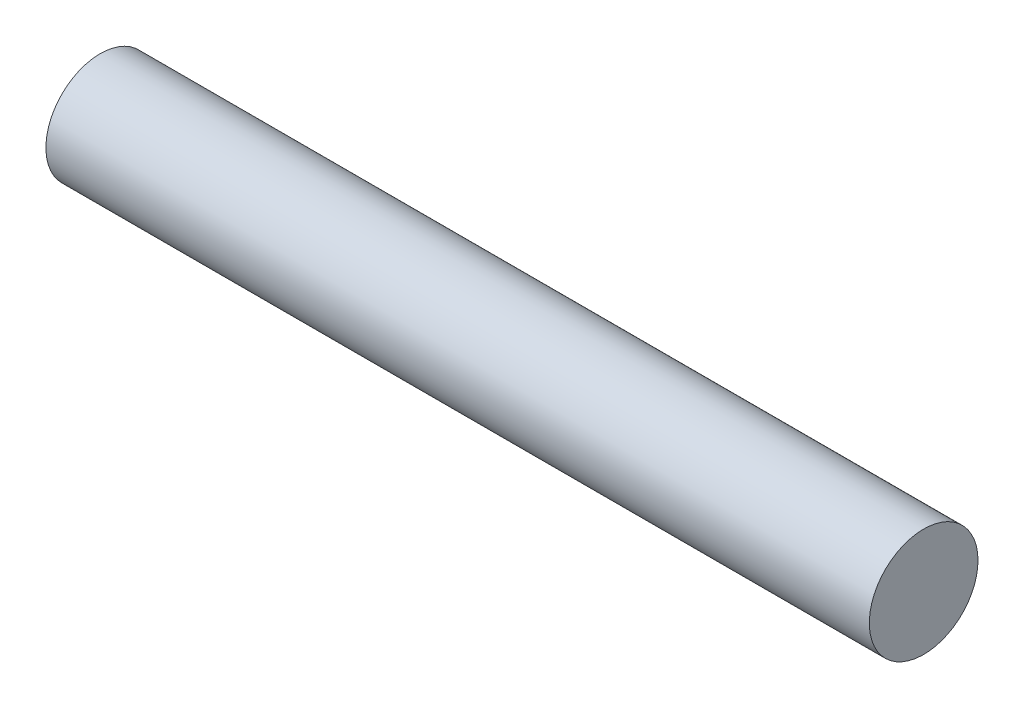
from build123d import *

# Parameters (mm, degrees)
CROQUIS2_R              = 25.146
SALIENTE_EXTRUIR1_DEPTH = 381


with BuildPart() as part:
    # Croquis2 → Saliente-Extruir1 (new body)
    with BuildSketch(Plane.YZ):
        with Locations(Location((0, 0, 0), (0, 0, 270))):
            Circle(CROQUIS2_R)
    extrude(amount=SALIENTE_EXTRUIR1_DEPTH)


solid = part.part
